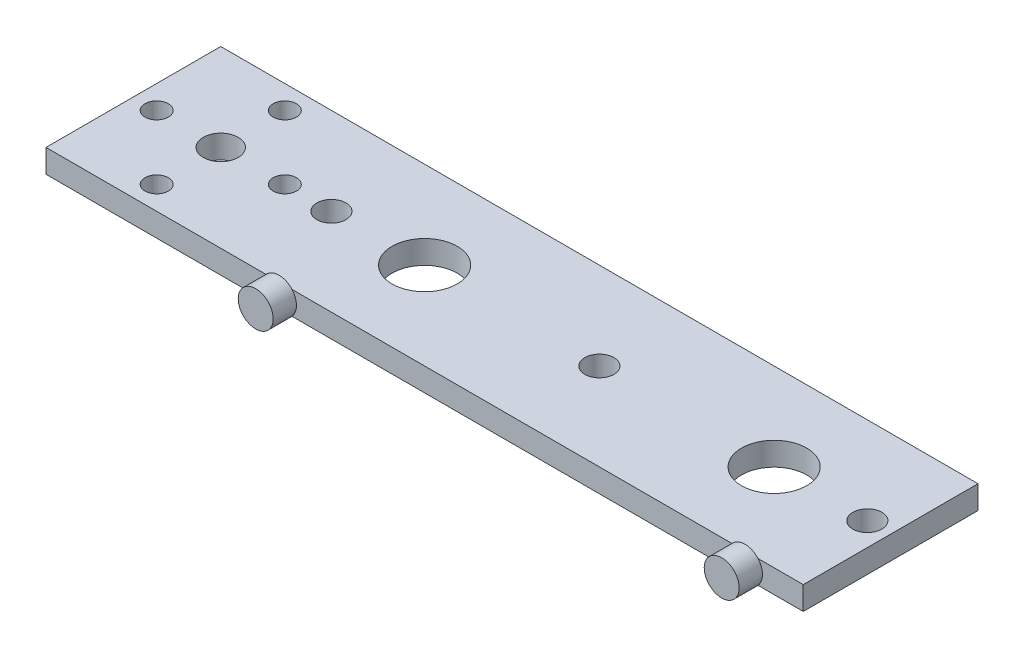
from build123d import *

# Parameters (mm, degrees)
SKETCH_1_W          = 65
SKETCH_1_H          = 15
EXTRUDE_1_DEPTH     = 2
SKETCH_2_R          = 1.25
SKETCH_2_R_2        = 2.8
SKETCH_2_R_3        = 1.5
SKETCH_2_R_4        = 1
CUT_EXTRUDE_1_DEPTH = 2
SKETCH_4_R          = 1.5
EXTRUDE_2_DEPTH     = 2


with BuildPart() as part:
    # 草图1 → 凸台-拉伸1 (new body)
    with BuildSketch(Plane(origin=(0, 0, 0), x_dir=(1, 0, 0), z_dir=(0, 1, 0))):
        with Locations((-7.5, 0)):
            Rectangle(SKETCH_1_W, SKETCH_1_H)
    extrude(amount=EXTRUDE_1_DEPTH)

    # 草图2 → 切除-拉伸1 (cut)
    with BuildSketch(Plane(origin=(0, 0, 0), x_dir=(1, 0, 0), z_dir=(0, 1, 0))):
        with Locations(Location((0, 0, 0), (0, 0, 270))):
            Circle(SKETCH_2_R)
        with Locations(Location((15, 0, 0), (0, 0, 270))):
            Circle(SKETCH_2_R_2)
        with Locations(Location((-15, 0, 0), (0, 0, 90))):
            Circle(SKETCH_2_R_2)
        with Locations(Location((23, 0, 0), (0, 0, 270))):
            Circle(SKETCH_2_R)
        with Locations(Location((-23, 0, 0), (0, 0, 90))):
            Circle(SKETCH_2_R)
        with Locations(Location((-32.5, 0, 0), (0, 0, 270))):
            Circle(SKETCH_2_R_3)
        with Locations(Location((-27, 0, 0), (0, 0, 270))):
            Circle(SKETCH_2_R_4)
        with Locations(Location((-32.5, -5.5, 0), (0, 0, 270))):
            Circle(SKETCH_2_R_4)
        with Locations(Location((-38, 0, 0), (0, 0, 270))):
            Circle(SKETCH_2_R_4)
        with Locations(Location((-32.5, 5.5, 0), (0, 0, 270))):
            Circle(SKETCH_2_R_4)
    extrude(amount=CUT_EXTRUDE_1_DEPTH, mode=Mode.SUBTRACT)

    # 草图4 → 凸台-拉伸2 (add)
    with BuildSketch(Plane.XY.offset(7.5)):
        with Locations(Location((20, 1, 0), (0, 0, 221.810314896))):
            Circle(SKETCH_4_R)
        with Locations(Location((-20, 1, 0), (0, 0, 221.810314896))):
            Circle(SKETCH_4_R)
    extrude(amount=EXTRUDE_2_DEPTH)


solid = part.part
